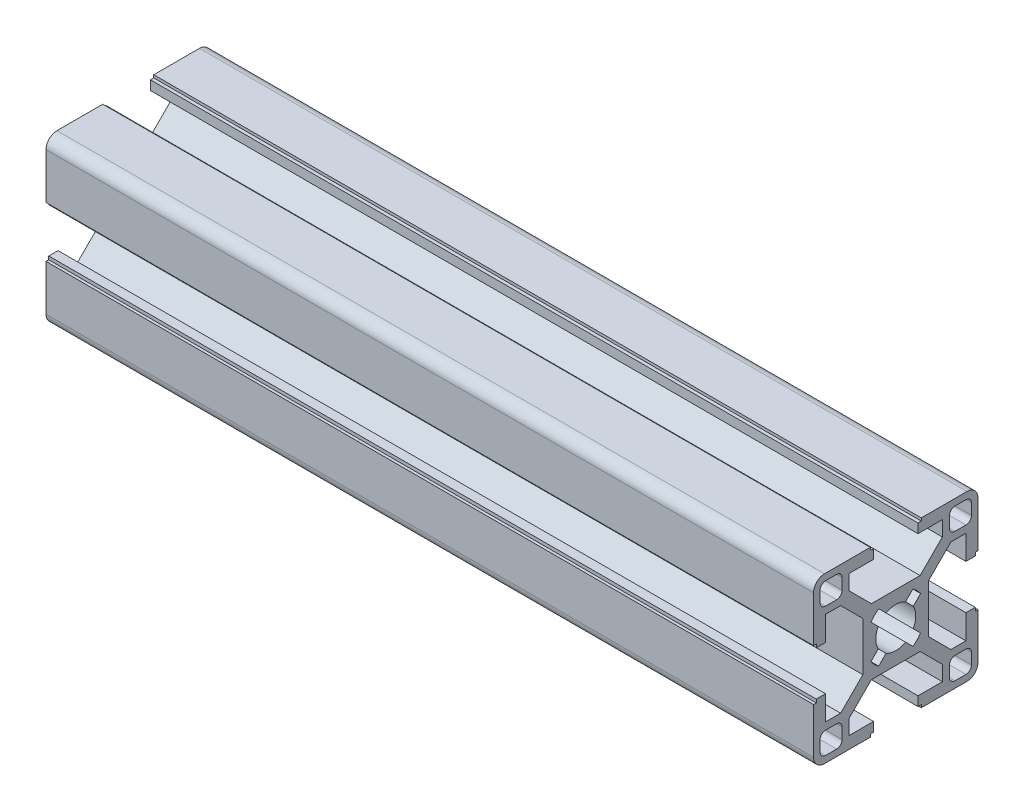
from build123d import *

# Parameters (mm, degrees)
AUFSATZ_LINEAR_AUSTRAGEN1_DEPTH = 140


with BuildPart() as part:
    # Skizze1 → Aufsatz-Linear austragen1 (new body)
    with BuildSketch(Plane(origin=(0, 0, 0), x_dir=(0, 0, -1), z_dir=(1, 0, 0))):
        with BuildLine():
            Line((10.055634919, 8.5), (12.8, 8.5))
            Line((12.8, 8.5), (12.8, 4.05))
            Line((12.8, 4.05), (14.5, 4.05))
            Line((14.5, 4.05), (14.5, 4.651637069))
            Line((14.5, 4.651637069), (15, 4.651637069))
            Line((15, 4.651637069), (15, 13))
            ThreePointArc((15, 13), (14.414213562, 14.414213562), (13, 15))
            Line((13, 15), (4.651637069, 15))
            Line((4.651637069, 15), (4.651637069, 14.5))
            Line((4.651637069, 14.5), (4.05, 14.5))
            Line((4.05, 14.5), (4.05, 12.8))
            Line((4.05, 12.8), (8.5, 12.8))
            Line((8.5, 12.8), (8.5, 10.055634919))
            Line((8.5, 10.055634919), (4.444365081, 6))
            Line((4.444365081, 6), (-4.444365081, 6))
            Line((-4.444365081, 6), (-8.5, 10.055634919))
            Line((-8.5, 10.055634919), (-8.5, 12.8))
            Line((-8.5, 12.8), (-4.05, 12.8))
            Line((-4.05, 12.8), (-4.05, 14.5))
            Line((-4.05, 14.5), (-4.651637069, 14.5))
            Line((-4.651637069, 14.5), (-4.651637069, 15))
            Line((-4.651637069, 15), (-13, 15))
            ThreePointArc((-13, 15), (-14.414213562, 14.414213562), (-15, 13))
            Line((-15, 13), (-15, 4.651637069))
            Line((-15, 4.651637069), (-14.5, 4.651637069))
            Line((-14.5, 4.651637069), (-14.5, 4.05))
            Line((-14.5, 4.05), (-12.8, 4.05))
            Line((-12.8, 4.05), (-12.8, 8.5))
            Line((-12.8, 8.5), (-10.055634919, 8.5))
            Line((-10.055634919, 8.5), (-6, 4.444365081))
            Line((-6, 4.444365081), (-6, -4.444365081))
            Line((-6, -4.444365081), (-10.055634919, -8.5))
            Line((-10.055634919, -8.5), (-12.8, -8.5))
            Line((-12.8, -8.5), (-12.8, -4.05))
            Line((-12.8, -4.05), (-14.5, -4.05))
            Line((-14.5, -4.05), (-14.5, -4.651637069))
            Line((-14.5, -4.651637069), (-15, -4.651637069))
            Line((-15, -4.651637069), (-15, -13))
            ThreePointArc((-15, -13), (-14.414213562, -14.414213562), (-13, -15))
            Line((-13, -15), (-4.651637069, -15))
            Line((-4.651637069, -15), (-4.651637069, -14.5))
            Line((-4.651637069, -14.5), (-4.05, -14.5))
            Line((-4.05, -14.5), (-4.05, -12.8))
            Line((-4.05, -12.8), (-8.5, -12.8))
            Line((-8.5, -12.8), (-8.5, -10.055634919))
            Line((-8.5, -10.055634919), (-4.444365081, -6))
            Line((-4.444365081, -6), (4.444365081, -6))
            Line((4.444365081, -6), (8.5, -10.055634919))
            Line((8.5, -10.055634919), (8.5, -12.8))
            Line((8.5, -12.8), (4.05, -12.8))
            Line((4.05, -12.8), (4.05, -14.5))
            Line((4.05, -14.5), (4.651637069, -14.5))
            Line((4.651637069, -14.5), (4.651637069, -15))
            Line((4.651637069, -15), (13, -15))
            ThreePointArc((13, -15), (14.414213562, -14.414213562), (15, -13))
            Line((15, -13), (15, -4.651637069))
            Line((15, -4.651637069), (14.5, -4.651637069))
            Line((14.5, -4.651637069), (14.5, -4.05))
            Line((14.5, -4.05), (12.8, -4.05))
            Line((12.8, -4.05), (12.8, -8.5))
            Line((12.8, -8.5), (10.055634919, -8.5))
            Line((10.055634919, -8.5), (6, -4.444365081))
            Line((6, -4.444365081), (6, 4.444365081))
            Line((6, 4.444365081), (10.055634919, 8.5))
        make_face()
        with BuildLine():
            ThreePointArc((12.8, 13.8), (13.507106781, 13.507106781), (13.8, 12.8))
            Line((13.8, 12.8), (13.8, 10.8))
            ThreePointArc((13.8, 10.8), (13.507106781, 10.092893219), (12.8, 9.8))
            Line((12.8, 9.8), (10.8, 9.8))
            ThreePointArc((10.8, 9.8), (10.092893219, 10.092893219), (9.8, 10.8))
            Line((9.8, 10.8), (9.8, 12.8))
            ThreePointArc((9.8, 12.8), (10.092893219, 13.507106781), (10.8, 13.8))
            Line((10.8, 13.8), (12.8, 13.8))
        make_face(mode=Mode.SUBTRACT)
        with BuildLine():
            Line((-3.117157854, 4.531371416), (-1.775079755, 3.189293317))
            ThreePointArc((-1.775079755, 3.189293317), (0, 3.65), (1.775079755, 3.189293317))
            Line((1.775079755, 3.189293317), (3.117157854, 4.531371416))
            ThreePointArc((3.117157854, 4.531371416), (3.889087297, 3.889087297), (4.531371416, 3.117157854))
            Line((4.531371416, 3.117157854), (3.189293317, 1.775079755))
            ThreePointArc((3.189293317, 1.775079755), (3.65, 0), (3.189293317, -1.775079755))
            Line((3.189293317, -1.775079755), (4.531371416, -3.117157854))
            ThreePointArc((4.531371416, -3.117157854), (3.889087297, -3.889087297), (3.117157854, -4.531371416))
            Line((3.117157854, -4.531371416), (1.775079755, -3.189293317))
            ThreePointArc((1.775079755, -3.189293317), (0, -3.65), (-1.775079755, -3.189293317))
            Line((-1.775079755, -3.189293317), (-3.117157854, -4.531371416))
            ThreePointArc((-3.117157854, -4.531371416), (-3.889087297, -3.889087297), (-4.531371416, -3.117157854))
            Line((-4.531371416, -3.117157854), (-3.189293317, -1.775079755))
            ThreePointArc((-3.189293317, -1.775079755), (-3.65, 0), (-3.189293317, 1.775079755))
            Line((-3.189293317, 1.775079755), (-4.531371416, 3.117157854))
            ThreePointArc((-4.531371416, 3.117157854), (-3.889087297, 3.889087297), (-3.117157854, 4.531371416))
        make_face(mode=Mode.SUBTRACT)
        with BuildLine():
            ThreePointArc((-13.8, 12.8), (-13.507106781, 13.507106781), (-12.8, 13.8))
            Line((-12.8, 13.8), (-10.8, 13.8))
            ThreePointArc((-10.8, 13.8), (-10.092893219, 13.507106781), (-9.8, 12.8))
            Line((-9.8, 12.8), (-9.8, 10.8))
            ThreePointArc((-9.8, 10.8), (-10.092893219, 10.092893219), (-10.8, 9.8))
            Line((-10.8, 9.8), (-12.8, 9.8))
            ThreePointArc((-12.8, 9.8), (-13.507106781, 10.092893219), (-13.8, 10.8))
            Line((-13.8, 10.8), (-13.8, 12.8))
        make_face(mode=Mode.SUBTRACT)
        with BuildLine():
            ThreePointArc((9.8, -10.8), (10.092893219, -10.092893219), (10.8, -9.8))
            Line((10.8, -9.8), (12.8, -9.8))
            ThreePointArc((12.8, -9.8), (13.507106781, -10.092893219), (13.8, -10.8))
            Line((13.8, -10.8), (13.8, -12.8))
            ThreePointArc((13.8, -12.8), (13.507106781, -13.507106781), (12.8, -13.8))
            Line((12.8, -13.8), (10.8, -13.8))
            ThreePointArc((10.8, -13.8), (10.092893219, -13.507106781), (9.8, -12.8))
            Line((9.8, -12.8), (9.8, -10.8))
        make_face(mode=Mode.SUBTRACT)
        with BuildLine():
            Line((-9.8, -10.8), (-9.8, -12.8))
            ThreePointArc((-9.8, -12.8), (-10.092893219, -13.507106781), (-10.8, -13.8))
            Line((-10.8, -13.8), (-12.8, -13.8))
            ThreePointArc((-12.8, -13.8), (-13.507106781, -13.507106781), (-13.8, -12.8))
            Line((-13.8, -12.8), (-13.8, -10.8))
            ThreePointArc((-13.8, -10.8), (-13.507106781, -10.092893219), (-12.8, -9.8))
            Line((-12.8, -9.8), (-10.8, -9.8))
            ThreePointArc((-10.8, -9.8), (-10.092893219, -10.092893219), (-9.8, -10.8))
        make_face(mode=Mode.SUBTRACT)
    extrude(amount=AUFSATZ_LINEAR_AUSTRAGEN1_DEPTH)


solid = part.part
